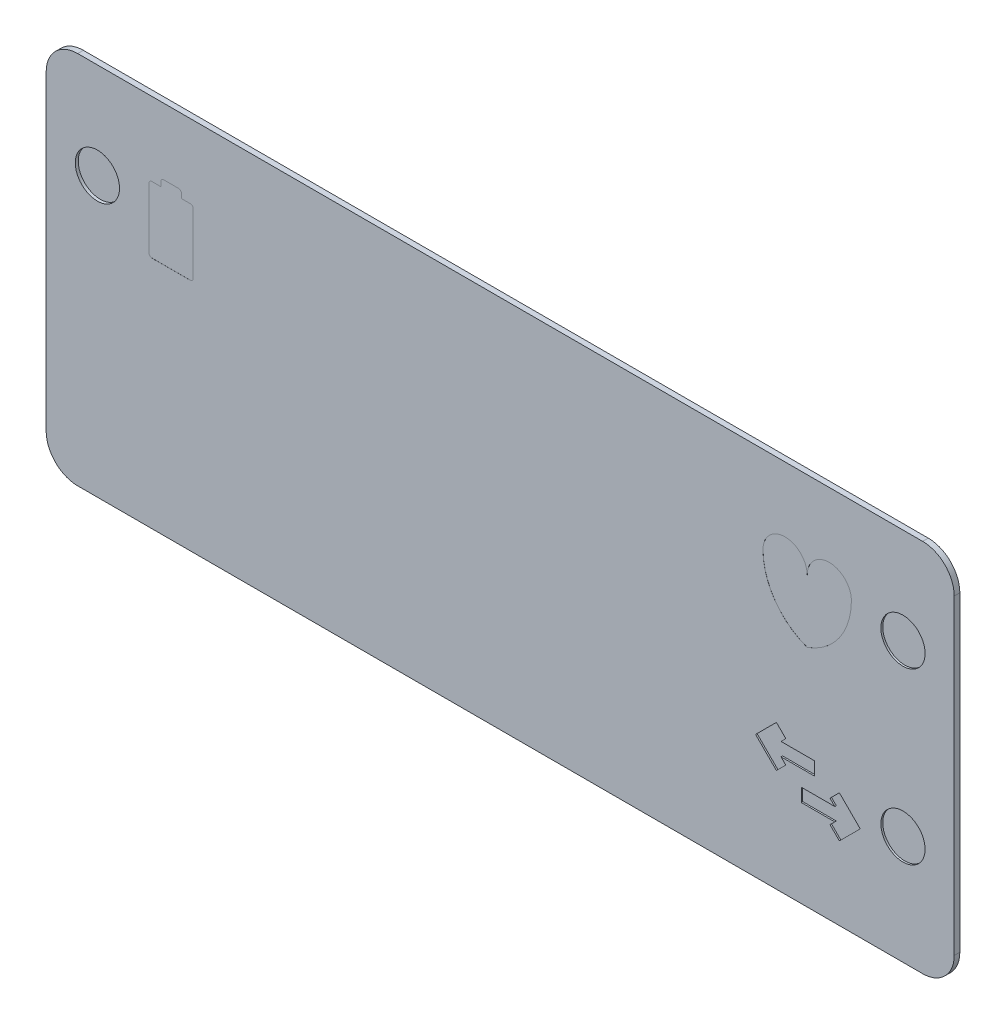
from build123d import *

# Parameters (mm, degrees)
BOSS_EXTRUDE1_DEPTH          = 0.381
SKETCH2_R                    = 1.5
CUT_EXTRUDE1_DEPTH           = 0.127
SKETCH17_R                   = 1.5
CUT_EXTRUDE9_DEPTH           = 0.2
HEART_SYM_CUT_EXTRUDE6_DEPTH = 0.005
BATT_SYM_CUT_EXTRUDE7_DEPTH  = 0.005
COMM_SYMCUT_EXTRUDE9_DEPTH   = 0.1


with BuildPart() as part:
    # Sketch1 → Boss-Extrude1 (new body)
    with BuildSketch(Plane.XY):
        with BuildLine():
            Line((2.14, 0), (59.46, 0))
            ThreePointArc((59.46, 0), (60.973208512, 0.626791488), (61.6, 2.14))
            Line((61.6, 2.14), (61.6, 23.26))
            ThreePointArc((61.6, 23.26), (60.973208512, 24.773208512), (59.46, 25.4))
            Line((59.46, 25.4), (2.14, 25.4))
            ThreePointArc((2.14, 25.4), (0.626791488, 24.773208512), (0, 23.26))
            Line((0, 23.26), (0, 2.14))
            ThreePointArc((0, 2.14), (0.626791488, 0.626791488), (2.14, 0))
        make_face()
    extrude(amount=BOSS_EXTRUDE1_DEPTH)

    # Sketch2 → Cut-Extrude1 (cut)
    with BuildSketch(Plane.XY.offset(0.381)):
        with Locations((58.125, 18.8976)):
            Circle(SKETCH2_R)
        with Locations((58.125, 7.3914)):
            Circle(SKETCH2_R)
    extrude(amount=-CUT_EXTRUDE1_DEPTH, mode=Mode.SUBTRACT)

    # Sketch17 → Cut-Extrude9 (cut)
    with BuildSketch(Plane.XY.offset(0.381)):
        with Locations((3.475, 18.8976)):
            Circle(SKETCH17_R)
    extrude(amount=-CUT_EXTRUDE9_DEPTH, mode=Mode.SUBTRACT)

    # Sketch10 → Heart Sym Cut-Extrude6 (cut)
    with BuildSketch(Plane.XY.offset(0.381)):
        with BuildLine():
            ThreePointArc((51.625, 19.4976), (50.125, 20.9976), (48.625, 19.4976))
            ThreePointArc((48.625, 19.4976), (49.450765386, 16.899523789), (51.625, 15.254959313))
            ThreePointArc((51.625, 15.254959313), (53.799234614, 16.899523789), (54.625, 19.4976))
            ThreePointArc((54.625, 19.4976), (53.125, 20.9976), (51.625, 19.4976))
        make_face()
    extrude(amount=-HEART_SYM_CUT_EXTRUDE6_DEPTH, mode=Mode.SUBTRACT)

    # Sketch11 → Batt Sym Cut-Extrude7 (cut)
    with BuildSketch(Plane.XY.offset(0.381)):
        with BuildLine():
            Line((7.175, 20.3976), (7.775, 20.3976))
            Line((7.775, 20.3976), (7.775, 20.6976))
            ThreePointArc((7.775, 20.6976), (7.833578644, 20.839021356), (7.975, 20.8976))
            Line((7.975, 20.8976), (8.975, 20.8976))
            ThreePointArc((8.975, 20.8976), (9.116421356, 20.839021356), (9.175, 20.6976))
            Line((9.175, 20.6976), (9.175, 20.3976))
            Line((9.175, 20.3976), (9.775, 20.3976))
            ThreePointArc((9.775, 20.3976), (9.916421356, 20.339021356), (9.975, 20.1976))
            Line((9.975, 20.1976), (9.975, 16.0976))
            ThreePointArc((9.975, 16.0976), (9.916421356, 15.956178644), (9.775, 15.8976))
            Line((9.775, 15.8976), (7.175, 15.8976))
            ThreePointArc((7.175, 15.8976), (7.033578644, 15.956178644), (6.975, 16.0976))
            Line((6.975, 16.0976), (6.975, 20.1976))
            ThreePointArc((6.975, 20.1976), (7.033578644, 20.339021356), (7.175, 20.3976))
        make_face()
    extrude(amount=-BATT_SYM_CUT_EXTRUDE7_DEPTH, mode=Mode.SUBTRACT)

    # Sketch13 → Comm SymCut-Extrude9 (cut)
    with BuildSketch(Plane.XY.offset(0.381)):
        Polygon((53.810786438, 7.805613562), (53.174390335, 7.169217459), (53.502207794, 6.8414), (51.225, 6.8414), (51.225, 5.9414), (53.502207794, 5.9414), (53.174390335, 5.613582541), (53.810786438, 4.977186438), (55.225, 6.3914), align=None)
        Polygon((49.847792206, 7.9414), (50.175609665, 7.613582541), (49.539213562, 6.977186438), (48.125, 8.3914), (49.539213562, 9.805613562), (50.175609665, 9.169217459), (49.847792206, 8.8414), (52.125, 8.8414), (52.125, 7.9414), align=None)
    extrude(amount=-COMM_SYMCUT_EXTRUDE9_DEPTH, mode=Mode.SUBTRACT)


solid = part.part
